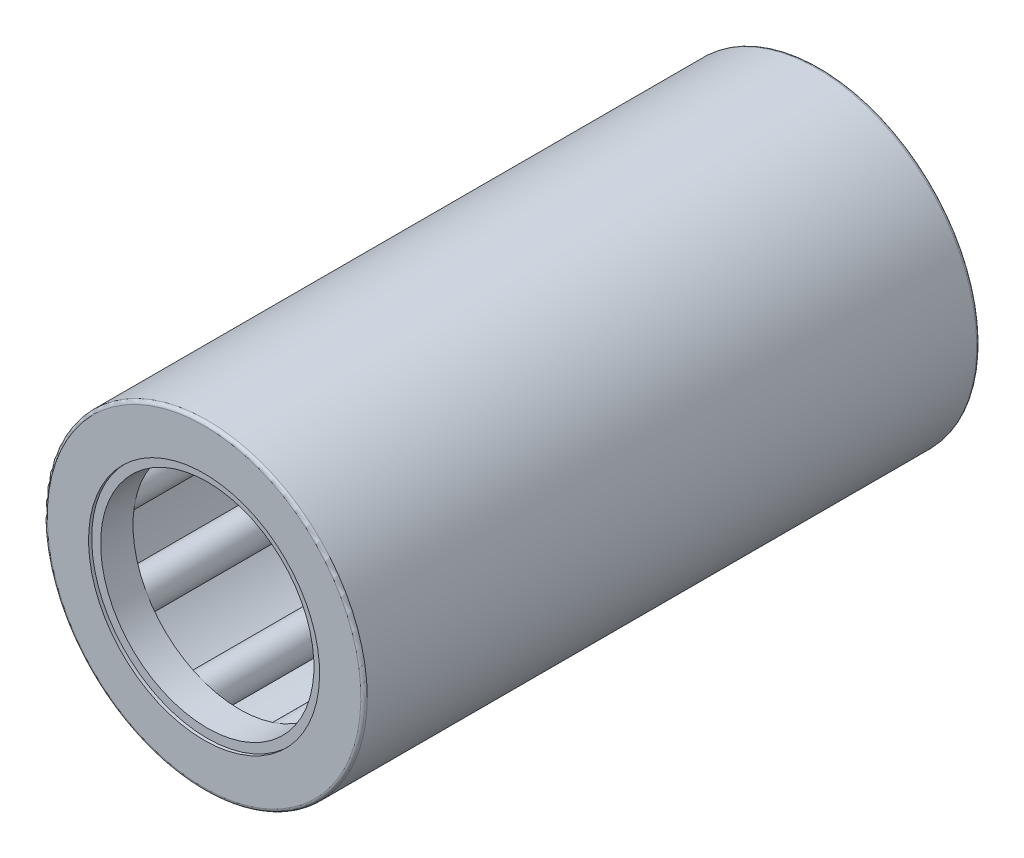
from build123d import *

# Parameters (mm, degrees)
SKETCH2_W         = 24.325
SKETCH2_H         = 0.5953125
SKETCH3_W         = 25.9125
SKETCH3_H         = 0.1984375
CIRPATTERN1_COUNT = 9
CIRPATTERN1_ANGLE = 320
FILLET1_R         = 0.142875
SKETCH4_W         = 1.444625
SKETCH4_H         = 0.396875
SKETCH5_W         = 1.444625
SKETCH5_H         = 0.396875


with BuildPart() as part:
    # Sketch1 → Revolve1 (revolve)
    with BuildSketch(Plane(origin=(0, 0, 0), x_dir=(0, 0, -1), z_dir=(1, 0, 0))):
        Polygon((-13.75, 7.14375), (13.75, 7.14375), (13.75, 5.159375), (12.95625, 5.159375), (12.95625, 6.35), (-12.95625, 6.35), (-12.95625, 5.159375), (-13.75, 5.159375), align=None)
    revolve(axis=Axis((0, 0, 13.75), (0, 0, -1)))

    # Fillet1
    fillet1_edges = [part.edges().sort_by_distance(p)[0] for p in [
        (0, -7.14375, -13.75),
        (0, -7.14375, 13.75),
    ]]
    fillet(fillet1_edges, radius=FILLET1_R)


with BuildPart() as body_2:
    # Sketch2 → Revolve2 (revolve)
    with BuildSketch(Plane(origin=(0, 0, 0), x_dir=(0, 0, -1), z_dir=(1, 0, 0))):
        with Locations((0, 6.05234375)):
            Rectangle(SKETCH2_W, SKETCH2_H)
    revolve(axis=Axis((0, 5.55625, 12.1625), (0, 0, -1)))


with BuildPart() as body_3:
    # Sketch3 → Revolve3 (revolve)
    with BuildSketch(Plane(origin=(0, 0, 0), x_dir=(0, 0, -1), z_dir=(1, 0, 0))):
        with Locations((0, 5.65546875)):
            Rectangle(SKETCH3_W, SKETCH3_H)
    revolve(axis=Axis((0, 5.55625, 12.95625), (0, 0, -1)))


with BuildPart() as cirpattern1_1:
    # CirPattern1: pattern copy
    add(body_2.part.rotate(Axis((0, 0, -13.75), (0, 0, 1)), 1 * CIRPATTERN1_ANGLE / (CIRPATTERN1_COUNT - 1)))


with BuildPart() as cirpattern1_2:
    # CirPattern1: pattern copy
    add(body_2.part.rotate(Axis((0, 0, -13.75), (0, 0, 1)), 2 * CIRPATTERN1_ANGLE / (CIRPATTERN1_COUNT - 1)))


with BuildPart() as cirpattern1_3:
    # CirPattern1: pattern copy
    add(body_2.part.rotate(Axis((0, 0, -13.75), (0, 0, 1)), 3 * CIRPATTERN1_ANGLE / (CIRPATTERN1_COUNT - 1)))


with BuildPart() as cirpattern1_4:
    # CirPattern1: pattern copy
    add(body_2.part.rotate(Axis((0, 0, -13.75), (0, 0, 1)), 4 * CIRPATTERN1_ANGLE / (CIRPATTERN1_COUNT - 1)))


with BuildPart() as cirpattern1_5:
    # CirPattern1: pattern copy
    add(body_2.part.rotate(Axis((0, 0, -13.75), (0, 0, 1)), 5 * CIRPATTERN1_ANGLE / (CIRPATTERN1_COUNT - 1)))


with BuildPart() as cirpattern1_6:
    # CirPattern1: pattern copy
    add(body_2.part.rotate(Axis((0, 0, -13.75), (0, 0, 1)), 6 * CIRPATTERN1_ANGLE / (CIRPATTERN1_COUNT - 1)))


with BuildPart() as cirpattern1_7:
    # CirPattern1: pattern copy
    add(body_2.part.rotate(Axis((0, 0, -13.75), (0, 0, 1)), 7 * CIRPATTERN1_ANGLE / (CIRPATTERN1_COUNT - 1)))


with BuildPart() as cirpattern1_8:
    # CirPattern1: pattern copy
    add(body_2.part.rotate(Axis((0, 0, -13.75), (0, 0, 1)), 8 * CIRPATTERN1_ANGLE / (CIRPATTERN1_COUNT - 1)))


with BuildPart() as cirpattern1_9:
    # CirPattern1: pattern copy
    add(body_3.part.rotate(Axis((0, 0, -13.75), (0, 0, 1)), 1 * CIRPATTERN1_ANGLE / (CIRPATTERN1_COUNT - 1)))


with BuildPart() as cirpattern1_10:
    # CirPattern1: pattern copy
    add(body_3.part.rotate(Axis((0, 0, -13.75), (0, 0, 1)), 2 * CIRPATTERN1_ANGLE / (CIRPATTERN1_COUNT - 1)))


with BuildPart() as cirpattern1_11:
    # CirPattern1: pattern copy
    add(body_3.part.rotate(Axis((0, 0, -13.75), (0, 0, 1)), 3 * CIRPATTERN1_ANGLE / (CIRPATTERN1_COUNT - 1)))


with BuildPart() as cirpattern1_12:
    # CirPattern1: pattern copy
    add(body_3.part.rotate(Axis((0, 0, -13.75), (0, 0, 1)), 4 * CIRPATTERN1_ANGLE / (CIRPATTERN1_COUNT - 1)))


with BuildPart() as cirpattern1_13:
    # CirPattern1: pattern copy
    add(body_3.part.rotate(Axis((0, 0, -13.75), (0, 0, 1)), 5 * CIRPATTERN1_ANGLE / (CIRPATTERN1_COUNT - 1)))


with BuildPart() as cirpattern1_14:
    # CirPattern1: pattern copy
    add(body_3.part.rotate(Axis((0, 0, -13.75), (0, 0, 1)), 6 * CIRPATTERN1_ANGLE / (CIRPATTERN1_COUNT - 1)))


with BuildPart() as cirpattern1_15:
    # CirPattern1: pattern copy
    add(body_3.part.rotate(Axis((0, 0, -13.75), (0, 0, 1)), 7 * CIRPATTERN1_ANGLE / (CIRPATTERN1_COUNT - 1)))


with BuildPart() as cirpattern1_16:
    # CirPattern1: pattern copy
    add(body_3.part.rotate(Axis((0, 0, -13.75), (0, 0, 1)), 8 * CIRPATTERN1_ANGLE / (CIRPATTERN1_COUNT - 1)))


with BuildPart() as body_20:
    # Sketch4 → Revolve4 (revolve)
    with BuildSketch(Plane(origin=(0, 0, 0), x_dir=(0, 0, -1), z_dir=(1, 0, 0))):
        with Locations((12.8848125, 4.9609375)):
            Rectangle(SKETCH4_W, SKETCH4_H)
    revolve(axis=Axis((0, 0, 13.75), (0, 0, -1)))


with BuildPart() as body_21:
    # Sketch5 → Revolve5 (revolve)
    with BuildSketch(Plane(origin=(0, 0, 0), x_dir=(0, 0, -1), z_dir=(1, 0, 0))):
        with Locations((-12.8848125, 4.9609375)):
            Rectangle(SKETCH5_W, SKETCH5_H)
    revolve(axis=Axis((0, 0, 13.75), (0, 0, -1)))


solid = Compound([part.part, body_2.part, body_3.part, cirpattern1_1.part, cirpattern1_2.part, cirpattern1_3.part, cirpattern1_4.part, cirpattern1_5.part, cirpattern1_6.part, cirpattern1_7.part, cirpattern1_8.part, cirpattern1_9.part, cirpattern1_10.part, cirpattern1_11.part, cirpattern1_12.part, cirpattern1_13.part, cirpattern1_14.part, cirpattern1_15.part, cirpattern1_16.part, body_20.part, body_21.part])
